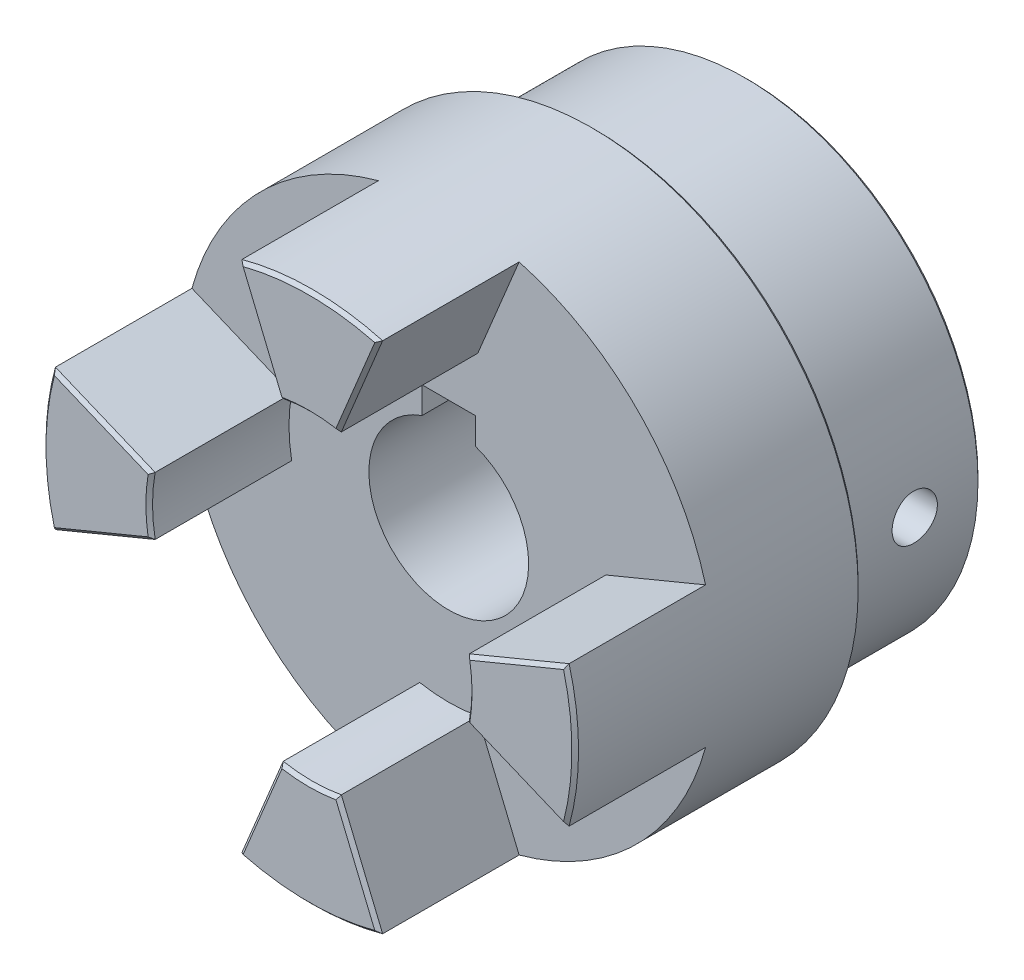
from build123d import *

# Parameters (mm, degrees)
SKETCH1_R                    = 35
BOSS_EXTRUDE1_DEPTH          = 23
SKETCH2_R                    = 40
BOSS_EXTRUDE2_DEPTH          = 22
BOSS_EXTRUDE3_DEPTH          = 21
CHAMFER1_SIZE                = 0.5
CIRPATTERN1_COUNT            = 4
CHAMFER1_OF_CIRPATTERN1_SIZE = 0.5
CUT_EXTRUDE1_REACH           = 74.284
CIRPATTERN2_COUNT            = 2
CIRPATTERN2_ANGLE            = 90.0000000000002
CHAMFER2_SIZE                = 0.5


with BuildPart() as part:
    # Sketch1 → Boss-Extrude1 (new body)
    with BuildSketch(Plane.XY):
        Circle(SKETCH1_R)
    extrude(amount=BOSS_EXTRUDE1_DEPTH)

    # Sketch2 → Boss-Extrude2 (add)
    with BuildSketch(Plane.XY.offset(23)):
        Circle(SKETCH2_R)
    extrude(amount=BOSS_EXTRUDE2_DEPTH)

    # Sketch3 → Boss-Extrude3 (add)
    with BuildSketch(Plane.XY.offset(45)):
        with BuildLine():
            ThreePointArc((-4.365000000000002, 23.599719807658737), (-2.1916574340201898, 23.89972045217065), (-3.535e-13, 24.000000000000004))
            Line((0, 24.000000000000004), (0, 40))
            ThreePointArc((2.45e-15, 40), (-5.332266542853259, 39.64299349842249), (-10.569350394509378, 38.578346675798386))
            Line((-10.569350394509376, 38.578346675798386), (-4.365000000000001, 23.599719807658737))
        make_face()
        with BuildLine():
            Line((0, 40), (0, 24.000000000000004))
            ThreePointArc((-3.535e-13, 24.000000000000004), (2.1916574340198385, 23.899720452170683), (4.365000000000001, 23.599719807658737))
            Line((4.365000000000001, 23.599719807658737), (10.569350394509376, 38.578346675798386))
            ThreePointArc((10.569350394509375, 38.578346675798386), (5.332266542853264, 39.64299349842249), (2.45e-15, 40))
        make_face()
    boss_extrude3 = extrude(amount=BOSS_EXTRUDE3_DEPTH)

    # Chamfer1
    chamfer1_edges = [part.edges().sort_by_distance(p)[0] for p in [
        (-2.22e-15, 24.000000000000007, 66),
        (7.467175197254688, 31.08903324172856, 66),
        (-5.11e-15, 40.000000000000014, 66),
        (-7.467175197254688, 31.08903324172856, 66),
    ]]
    chamfer(chamfer1_edges, length=CHAMFER1_SIZE)

    # CirPattern1: Boss-Extrude3 ×4 about axis
    cirpattern1_axis = Axis((-1e-15, 7.77e-15, 0), (0, 0, 1))
    for i in range(1, CIRPATTERN1_COUNT):
        add(boss_extrude3.rotate(cirpattern1_axis, i * 360 / CIRPATTERN1_COUNT))

    # Chamfer1 of CirPattern1
    chamfer1_of_cirpattern1_edges = [part.edges().sort_by_distance(p)[0] for p in [
        (-24, 8.02e-15, 66),
        (-31.089033241728554, 7.467175197254699, 66),
        (-40.00000000000001, 6.11e-15, 66),
        (-31.089033241728554, -7.467175197254678, 66),
        (-2.72e-15, -23.999999999999993, 66),
        (-7.467175197254694, -31.089033241728547, 66),
        (-1.79e-15, -40, 66),
        (7.467175197254683, -31.089033241728547, 66),
        (24, 4.58e-15, 66),
        (31.089033241728554, -7.4671751972546865, 66),
        (40.00000000000001, 4.52e-15, 66),
        (31.089033241728554, 7.46717519725469, 66),
    ]]
    chamfer(chamfer1_of_cirpattern1_edges, length=CHAMFER1_OF_CIRPATTERN1_SIZE)

    # Sketch4 → Cut-Extrude1 (cut, up to next)
    with BuildSketch(Plane.XY.offset(45), mode=Mode.PRIVATE) as cut_extrude1_sk1:
        with BuildLine():
            Line((-4, 11.31370849898476), (-4, 15.3))
            Line((-4, 15.3), (4, 15.3))
            Line((4, 15.3), (4, 11.31370849898476))
            ThreePointArc((4, 11.31370849898476), (-2.2e-15, -11.999999999999998), (-4, 11.31370849898476))
        make_face()
    cut_extrude1_tool1 = extrude(cut_extrude1_sk1.sketch, amount=-CUT_EXTRUDE1_REACH, mode=Mode.PRIVATE) & part.part
    add(cut_extrude1_tool1.solids().sort_by_distance((0, 0.794205, 45))[0], mode=Mode.SUBTRACT)

    # Sketch6 → M8x1.25 Tapped Hole1 (revolve, cut)
    with BuildSketch(Plane(origin=(0, 0, 10), x_dir=(0, 0, 1), z_dir=(0, 1, 0))):
        Polygon((0, 0), (-9.8e-15, 40), (3.39999999999999, 40), (3.399999999999995, 3.6e-16), align=None)
    m8x1_25_tapped_hole1 = revolve(axis=Axis((-6.349999999999991, 0, 10), (1, 0, 0)), mode=Mode.SUBTRACT)

    # CirPattern2: M8x1.25 Tapped Hole1 ×2 about axis
    cirpattern2_axis = Axis((0, 0, 0), (0, 0, -1))
    for i in range(1, CIRPATTERN2_COUNT):
        add(m8x1_25_tapped_hole1.rotate(cirpattern2_axis, i * CIRPATTERN2_ANGLE / (CIRPATTERN2_COUNT - 1)), mode=Mode.SUBTRACT)

    # Chamfer2
    chamfer2_edges = [part.edges().sort_by_distance(p)[0] for p in [
        (-35, 4.29e-15, 0),
        (-40, 4.9e-15, 23),
    ]]
    chamfer(chamfer2_edges, length=CHAMFER2_SIZE)


solid = part.part
